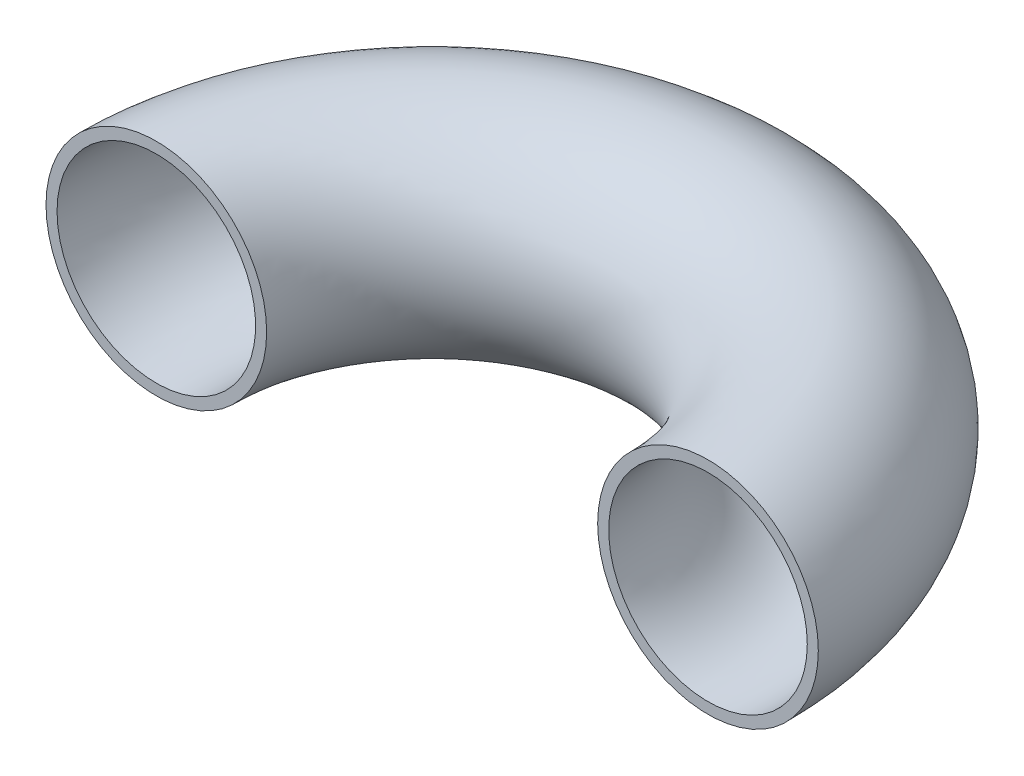
from build123d import *

# Parameters (mm, degrees)
SKETCH1_R = 5
SHELL1_T  = -0.5


with BuildPart() as part:
    # Sweep1: sweep along a path in Sketch2
    with BuildLine(Plane(origin=(0, 0, 0), x_dir=(1, 0, 0), z_dir=(0, 1, 0))) as sweep1_path:
        ThreePointArc((0, 0), (12.5, 12.5), (25, 0))
    # Sketch1 → Sweep1 (sweep)
    with BuildSketch(Plane.XY):
        Circle(SKETCH1_R)
    sweep(path=sweep1_path.line)

    # Shell1
    shell1_openings = [part.faces().sort_by_distance(p)[0] for p in [
        (25, 0, 0),
        (0, 0, 0),
    ]]
    offset(amount=SHELL1_T, openings=shell1_openings, kind=Kind.INTERSECTION)


solid = part.part
